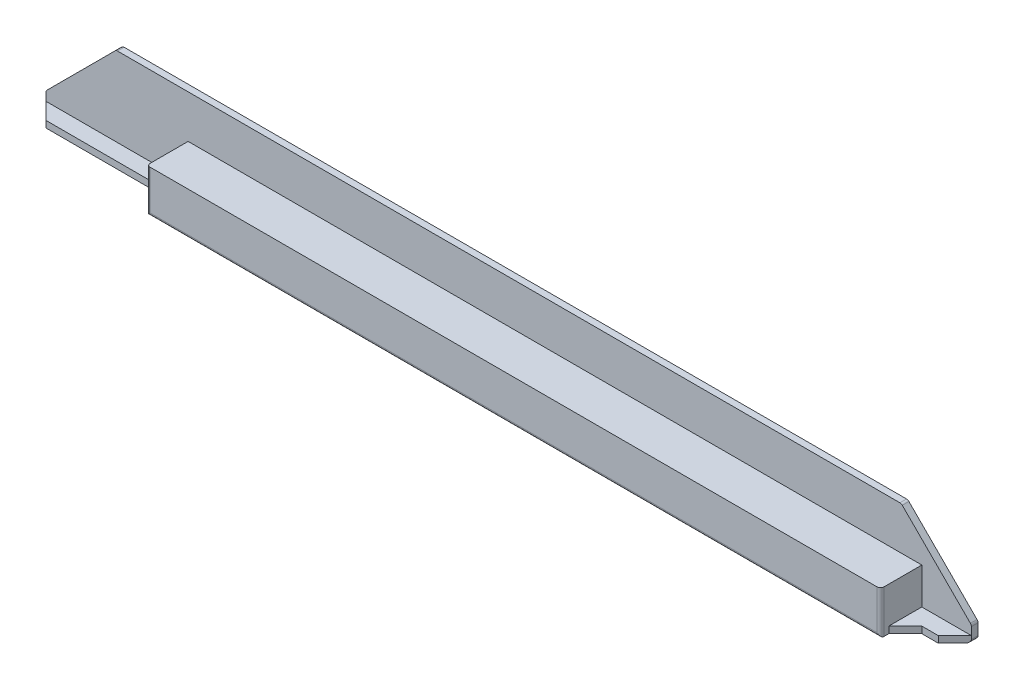
from build123d import *

# Parameters (mm, degrees)
BOSS_EXTRUDE1_DEPTH = 2
SKETCH10_W          = 280
SKETCH10_H          = 7
BOSS_EXTRUDE3_DEPTH = 2
SKETCH3_W           = 222
SKETCH3_H           = 13
BOSS_EXTRUDE4_DEPTH = 12.5
CHAMFER1_SIZE       = 5
FILLET1_R           = 1


with BuildPart() as part:
    # Sketch1 → Boss-Extrude1 (new body)
    with BuildSketch(Plane.XY):
        with BuildLine():
            Line((21.213203436, 24), (0, 2.786796564))
            Line((0, 2.786796564), (0, 0))
            Line((0, 0), (42, 0))
            Line((42, 0), (42, 11))
            ThreePointArc((42, 11), (43.171572875, 13.828427125), (46, 15))
            Line((46, 15), (262, 15))
            ThreePointArc((262, 15), (264.828427125, 13.828427125), (266, 11))
            Line((266, 11), (266, 0))
            Line((266, 0), (280, 0))
            Line((280, 0), (280, 2.786796564))
            Line((280, 2.786796564), (258.786796564, 24))
            Line((258.786796564, 24), (21.213203436, 24))
        make_face()
        with BuildLine():
            Line((42, 11), (42, 0))
            Line((42, 0), (266, 0))
            Line((266, 0), (266, 11))
            ThreePointArc((266, 11), (264.828427125, 13.828427125), (262, 15))
            Line((262, 15), (46, 15))
            ThreePointArc((46, 15), (43.171572875, 13.828427125), (42, 11))
        make_face()
    extrude(amount=BOSS_EXTRUDE1_DEPTH)

    # Sketch10 → Boss-Extrude3 (add)
    with BuildSketch(Plane.XZ):
        with Locations((140, 3.5)):
            Rectangle(SKETCH10_W, SKETCH10_H)
    extrude(amount=BOSS_EXTRUDE3_DEPTH)

    # Sketch3 → Boss-Extrude4 (add)
    with BuildSketch(Plane.XY.offset(2)):
        with Locations((154, 4.5)):
            Rectangle(SKETCH3_W, SKETCH3_H)
    extrude(amount=BOSS_EXTRUDE4_DEPTH)

    # Chamfer1
    chamfer1_edges = [part.edges().sort_by_distance(p)[0] for p in [
        (43, -1, 7),
        (0, -1, 7),
        (280, -1, 7),
        (265, -1, 7),
    ]]
    chamfer(chamfer1_edges, length=CHAMFER1_SIZE)

    # Fillet1
    fillet1_edges = [part.edges().sort_by_distance(p)[0] for p in [
        (0, 2.786796564, 1),
        (21.213203436, 24, 1),
        (258.786796564, 24, 1),
        (280, 2.786796564, 1),
        (280, -2, 1),
        (43, 4.5, 14.5),
        (154, -2, 14.5),
        (265, 4.5, 14.5),
        (0, -2, 1),
    ]]
    fillet(fillet1_edges, radius=FILLET1_R)


solid = part.part
